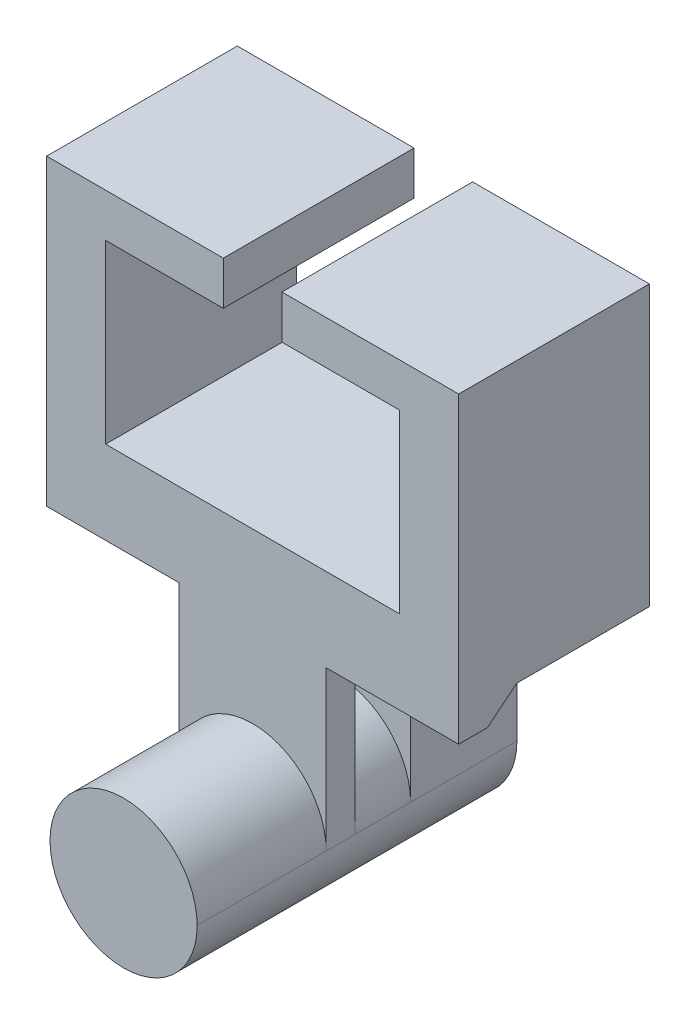
from build123d import *

# Parameters (mm, degrees)
SKETCH1_R                = 15.875
BOSS_EXTRUDE1_DEPTH      = 50.8
SKETCH2_W                = 31.75
SKETCH2_H                = 50.8
BOSS_EXTRUDE2_DEPTH      = 4.7625
SKETCH3_W                = 88.9
SKETCH3_H                = 41.148
BOSS_EXTRUDE3_DEPTH      = 41.2496
CUT_EXTRUDE2_DEPTH       = 111.191148756
BOSS_EXTRUDE4_REACH      = 96.879
BOSS_EXTRUDE4_END_RADIUS = 15.875
SKETCH12_W               = 31.75
SKETCH12_H               = 6.203370687
SKETCH13_W               = 31.75
SKETCH13_H               = 4.7625
BOSS_EXTRUDE5_DEPTH      = 11.43
SKETCH14_W               = 38.1254
SKETCH14_H               = 41.148
BOSS_EXTRUDE6_DEPTH      = 7.62
SKETCH20_W               = 31.75
SKETCH20_H               = 5.130323172
BOSS_EXTRUDE7_DEPTH      = 6.35
CUT_EXTRUDE3_DEPTH       = 128.097501113
BOSS_EXTRUDE8_START      = 18.19275
BOSS_EXTRUDE8_DEPTH      = 18.19275
SKETCH25_W               = 28.575
SKETCH25_H               = 22.95525
BOSS_EXTRUDE10_DEPTH     = 6.35
CUT_EXTRUDE4_DEPTH       = 119.44527458
BOSS_EXTRUDE11_DEPTH     = 28.575
BOSS_EXTRUDE12_DEPTH     = 28.575


with BuildPart() as part:
    # Sketch1 → Boss-Extrude1 (new body)
    with BuildSketch(Plane.XY):
        Circle(SKETCH1_R)
    extrude(amount=BOSS_EXTRUDE1_DEPTH)

    # Sketch2 → Boss-Extrude2 (add)
    with BuildSketch(Plane(origin=(0, 0, 0), x_dir=(-1, 0, 0), z_dir=(0, 0, -1))):
        with Locations((0, 25.4)):
            Rectangle(SKETCH2_W, SKETCH2_H)
    extrude(amount=-BOSS_EXTRUDE2_DEPTH)

    # Sketch3 → Boss-Extrude3 (add)
    with BuildSketch(Plane(origin=(0, 50.8, 0), x_dir=(1, 0, 0), z_dir=(0, 1, 0))):
        with Locations((0, -2.38125)):
            Rectangle(SKETCH3_W, SKETCH3_H)
    extrude(amount=BOSS_EXTRUDE3_DEPTH)

    # Sketch5 → Cut-Extrude2 (cut, through all)
    with BuildSketch(Plane.XY.offset(22.95525)):
        Polygon((-6.3246, 92.0496), (-6.3246, 90.297), (-31.70428, 90.297), (-31.70428, 52.2224), (31.70428, 52.2224), (31.70428, 90.297), (6.3246, 90.297), (6.3246, 92.0496), align=None)
    extrude(amount=-CUT_EXTRUDE2_DEPTH, mode=Mode.SUBTRACT)

    # Boss-Extrude4: up to this cylinder (the profile starts outside it)
    boss_extrude4_end = Plane(origin=(0, 0, 19.853565), z_dir=(0, 0, -1)) * Cylinder(BOSS_EXTRUDE4_END_RADIUS, 226.508, mode=Mode.PRIVATE)
    # Sketch12 → Boss-Extrude4 (add, up to the surface)
    with BuildSketch(Plane.XZ.offset(-50.8), mode=Mode.PRIVATE) as boss_extrude4_sk1:
        with Locations((0, 19.853564657)):
            Rectangle(SKETCH12_W, SKETCH12_H)
    boss_extrude4_tool1 = extrude(boss_extrude4_sk1.sketch, amount=BOSS_EXTRUDE4_REACH, mode=Mode.PRIVATE) - boss_extrude4_end
    add(boss_extrude4_tool1.solids().sort_by_distance((0, 50.8, 19.853565))[0])

    # Sketch13 → Boss-Extrude5 (add)
    with BuildSketch(Plane.XZ.offset(-50.8)):
        Polygon((-44.45, 22.95525), (-15.875, 22.95525), (-15.875, 16.751879313), (15.875, 16.751879313), (15.875, 22.95525), (44.45, 22.95525), (44.45, -18.19275), (-44.45, -18.19275), align=None)
        with Locations((0, 2.38125)):
            Rectangle(SKETCH13_W, SKETCH13_H, mode=Mode.SUBTRACT)
    extrude(amount=BOSS_EXTRUDE5_DEPTH)

    # Sketch14 → Boss-Extrude6 (add)
    with BuildSketch(Plane(origin=(0, 92.0496, 0), x_dir=(1, 0, 0), z_dir=(0, 1, 0))):
        with Locations((-25.3873, -2.38125)):
            Rectangle(SKETCH14_W, SKETCH14_H)
        with Locations((25.3873, -2.38125)):
            Rectangle(SKETCH14_W, SKETCH14_H)
    extrude(amount=BOSS_EXTRUDE6_DEPTH)

    # Sketch20 → Boss-Extrude7 (add)
    with BuildSketch(Plane(origin=(0, 0, 16.751879313), x_dir=(-1, 0, 0), z_dir=(0, 0, -1))):
        with Locations((0, 36.804838414)):
            Rectangle(SKETCH20_W, SKETCH20_H)
    extrude(amount=BOSS_EXTRUDE7_DEPTH)

    # Sketch21 → Cut-Extrude3 (cut, through all)
    with BuildSketch(Plane(origin=(15.875, 0, 0), x_dir=(0, 0, -1), z_dir=(1, 0, 0))):
        Polygon((-16.751879313, 34.239676828), (-10.401879313, 39.37), (-10.401879313, 34.239676828), align=None)
    extrude(amount=-CUT_EXTRUDE3_DEPTH, mode=Mode.SUBTRACT)

    # Sketch22 → Boss-Extrude8 (add)
    with BuildSketch(Plane(origin=(0, 0, 0), x_dir=(-1, 0, 0), z_dir=(0, 0, -1)).offset(BOSS_EXTRUDE8_START)):
        with BuildLine():
            Line((-15.875, 39.37), (15.875, 39.37))
            Line((15.875, 39.37), (15.875, 0))
            ThreePointArc((15.875, 0), (0, -15.875), (-15.875, 0))
            Line((-15.875, 0), (-15.875, 39.37))
        make_face()
    extrude(amount=-BOSS_EXTRUDE8_DEPTH)

    # Sketch25 → Boss-Extrude10 (add)
    with BuildSketch(Plane.XZ.offset(-39.37)):
        with Locations((-30.1625, -6.715125)):
            Rectangle(SKETCH25_W, SKETCH25_H)
        with Locations((30.1625, -6.715125)):
            Rectangle(SKETCH25_W, SKETCH25_H)
    extrude(amount=BOSS_EXTRUDE10_DEPTH)

    # Sketch26 → Cut-Extrude4 (cut, through all)
    with BuildSketch(Plane.XY.offset(4.7625)):
        Polygon((-44.45, 39.37), (-16.350375035, 33.02), (-44.45, 33.02), align=None)
        Polygon((15.875, 33.02), (44.45, 39.37), (44.45, 33.02), align=None)
    extrude(amount=-CUT_EXTRUDE4_DEPTH, mode=Mode.SUBTRACT)

    # Sketch27 → Boss-Extrude11 (add)
    with BuildSketch(Plane.ZY.offset(15.875)):
        Polygon((16.751879313, 34.239676828), (22.95525, 34.239676828), (22.95525, 39.37), (10.401879313, 39.37), align=None)
    extrude(amount=BOSS_EXTRUDE11_DEPTH)

    # Sketch28 → Boss-Extrude12 (add)
    with BuildSketch(Plane(origin=(15.875, 0, 0), x_dir=(0, 0, -1), z_dir=(1, 0, 0))):
        Polygon((-16.751879313, 34.239676828), (-22.95525, 34.239676828), (-22.95525, 39.37), (-10.401879313, 39.37), align=None)
    extrude(amount=BOSS_EXTRUDE12_DEPTH)


solid = part.part
